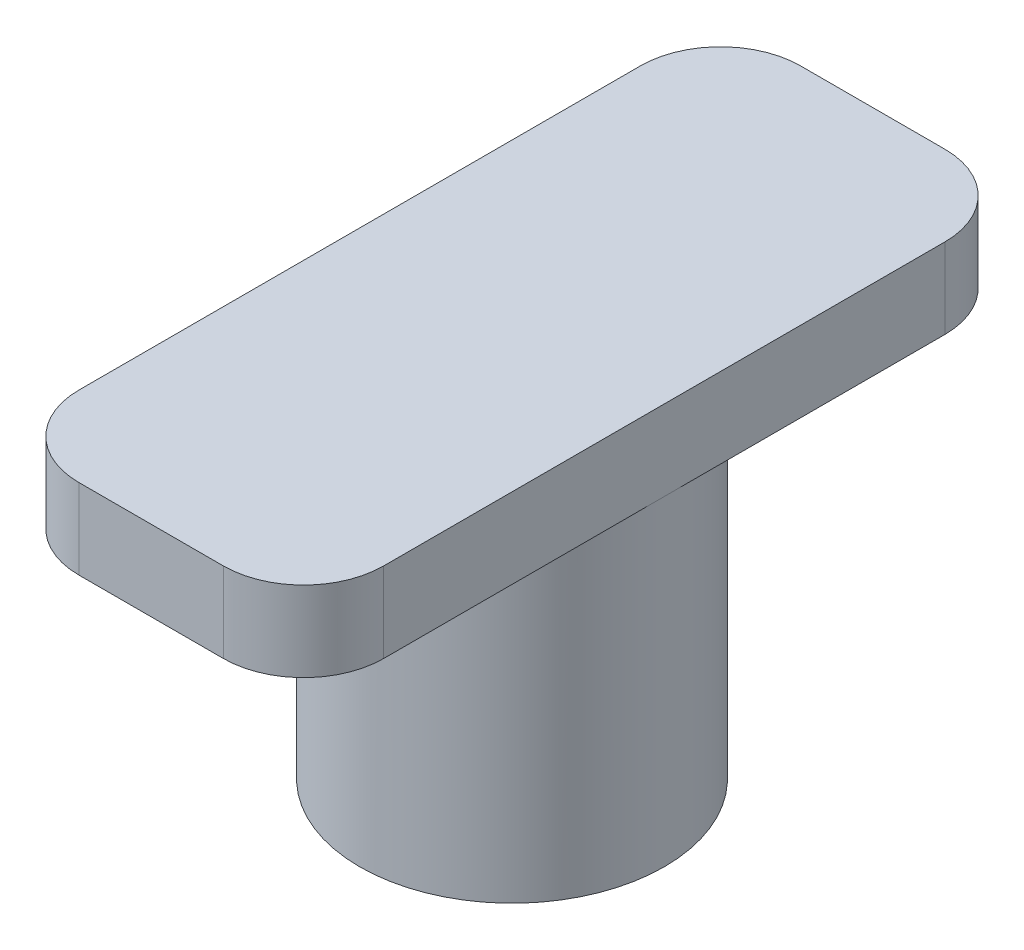
from build123d import *

# Parameters (mm, degrees)
SKETCH1_R           = 38
BOSS_EXTRUDE1_DEPTH = 80
SKETCH2_R           = 29
CUT_EXTRUDE1_DEPTH  = 75
BOSS_EXTRUDE2_DEPTH = 20


with BuildPart() as part:
    # Sketch1 → Boss-Extrude1 (new body)
    with BuildSketch(Plane(origin=(0, 0, 0), x_dir=(1, 0, 0), z_dir=(0, 1, 0))):
        with Locations(Location((0, 0, 0), (0, 0, 270))):
            Circle(SKETCH1_R)
    extrude(amount=BOSS_EXTRUDE1_DEPTH)

    # Sketch2 → Cut-Extrude1 (cut)
    with BuildSketch(Plane.XZ):
        with Locations(Location((0, 0, 0), (0, 0, 270))):
            Circle(SKETCH2_R)
    extrude(amount=-CUT_EXTRUDE1_DEPTH, mode=Mode.SUBTRACT)

    # Sketch3 → Boss-Extrude2 (add)
    with BuildSketch(Plane(origin=(0, 80, 0), x_dir=(1, 0, 0), z_dir=(0, 1, 0))):
        with BuildLine():
            Line((18, -90), (-18, -90))
            ThreePointArc((-18, -90), (-32.142135624, -84.142135624), (-38, -70))
            Line((-38, -70), (-38, 70))
            ThreePointArc((-38, 70), (-32.142135624, 84.142135624), (-18, 90))
            Line((-18, 90), (18, 90))
            ThreePointArc((18, 90), (32.142135624, 84.142135624), (38, 70))
            Line((38, 70), (38, -70))
            ThreePointArc((38, -70), (32.142135624, -84.142135624), (18, -90))
        make_face()
    extrude(amount=BOSS_EXTRUDE2_DEPTH)


solid = part.part
